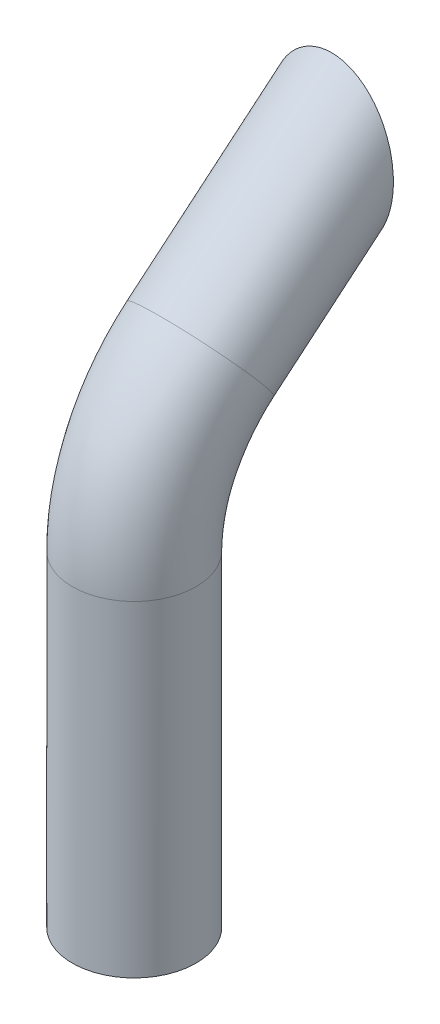
from build123d import *

# Parameters (mm, degrees)
SKETCH2_R          = 30
SKETCH2_R_2        = 27
SKETCH3_W          = 78.838070696
SKETCH3_H          = 95.634949563
CUT_EXTRUDE1_DEPTH = 75


with BuildPart() as part:
    # Sweep-Thin1: sweep along a path in Sketch1
    with BuildLine(Plane(origin=(0, 0, 0), x_dir=(0, 0, -1), z_dir=(1, 0, 0))) as sweep_thin1_path:
        Line((0, 0), (-82.75755134, -69.441830806))
        ThreePointArc((-82.75755134, -69.441830806), (-106.474367301, -100.35018713), (-114.906666468, -138.385830687))
        Line((-114.906666468, -138.385830687), (-114.906666468, -296.418141453))
    # Sketch2 → Sweep-Thin1 (sweep)
    with BuildSketch(Plane(origin=(0, 0, 0), x_dir=(1, 0, 0), z_dir=(0, -0.6427876096865379, 0.7660444431189793))):
        Circle(SKETCH2_R)
        Circle(SKETCH2_R_2, mode=Mode.SUBTRACT)
    sweep(path=sweep_thin1_path.line)

    # Sketch3 → Cut-Extrude1 (cut, symmetric)
    with BuildSketch(Plane(origin=(0, 0, 0), x_dir=(0, 0, -1), z_dir=(1, 0, 0))):
        with Locations((20.135407057, -24.836141488)):
            Rectangle(SKETCH3_W, SKETCH3_H)
    extrude(amount=CUT_EXTRUDE1_DEPTH, both=True, mode=Mode.SUBTRACT)


solid = part.part
